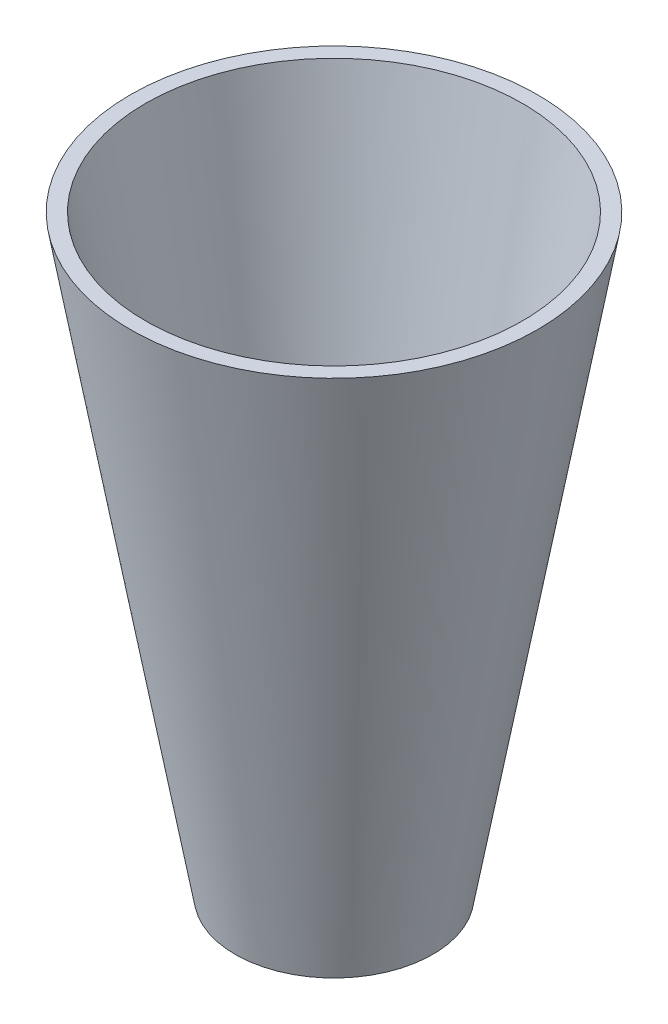
from build123d import *


with BuildPart() as part:
    # Sketch1 → Revolve1 (revolve)
    with BuildSketch(Plane.XY, mode=Mode.PRIVATE) as revolve1_sk:
        Polygon((0, 0), (10, 0), (20.579618843, 60), (19.056478925, 60), (8.741350553, 1.5), (0, 1.5), align=None)
    revolve(revolve1_sk.sketch.rotate(Axis((0, 1.5, 0), (0, -1, 0)), 180), axis=Axis((0, 1.5, 0), (0, -1, 0)))


solid = part.part
